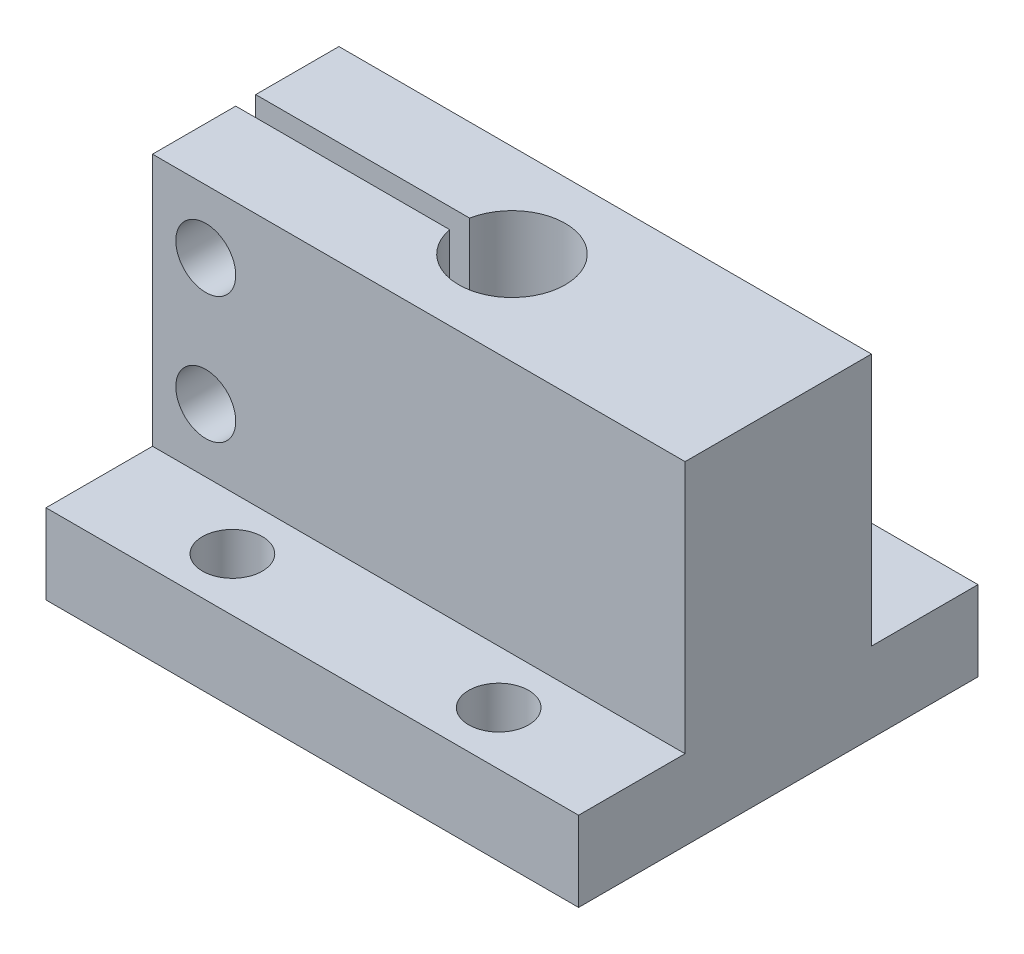
from build123d import *

# Parameters (mm, degrees)
SKETCH2_W               = 40
SKETCH2_H               = 14
SKETCH2_R               = 4
BOSS_EXTRUDE_WALL_DEPTH = 25
SKETCH2_3_W             = 40
SKETCH2_3_H             = 8
SKETCH2_3_R             = 2.25
BOSS_EXTRUDE2_DEPTH     = 6
SKETCH3_W               = 20
SKETCH3_H               = 1.5
CUT_EXTRUDE1_DEPTH      = 36.355339059
SKETCH4_R               = 2.25
CUT_EXTRUDE2_DEPTH      = 39.845849199


with BuildPart() as part:
    # Sketch2 → Boss-Extrude_wall (new body)
    with BuildSketch(Plane(origin=(0, 0, 0), x_dir=(1, 0, 0), z_dir=(0, 1, 0))):
        Rectangle(SKETCH2_W, SKETCH2_H)
        Circle(SKETCH2_R, mode=Mode.SUBTRACT)
    extrude(amount=BOSS_EXTRUDE_WALL_DEPTH)

    # Sketch2<3> → Boss-Extrude2 (add)
    # profile 1 of 2: a face of its own
    with BuildSketch(Plane(origin=(0, 0, 0), x_dir=(1, 0, 0), z_dir=(0, 1, 0))):
        with Locations((0, 11)):
            Rectangle(SKETCH2_3_W, SKETCH2_3_H)
        with Locations((-10, 11)):
            Circle(SKETCH2_3_R, mode=Mode.SUBTRACT)
        with Locations((10, 11)):
            Circle(SKETCH2_3_R, mode=Mode.SUBTRACT)
    # profile 2 of 2: a face of its own
    with BuildSketch(Plane(origin=(0, 0, 0), x_dir=(1, 0, 0), z_dir=(0, 1, 0))):
        with Locations((0, -11)):
            Rectangle(SKETCH2_3_W, SKETCH2_3_H)
        with Locations((-10, -11)):
            Circle(SKETCH2_3_R, mode=Mode.SUBTRACT)
        with Locations((10, -11)):
            Circle(SKETCH2_3_R, mode=Mode.SUBTRACT)
    extrude(amount=BOSS_EXTRUDE2_DEPTH)

    # Sketch3 → Cut-Extrude1 (cut, through all)
    with BuildSketch(Plane(origin=(0, 25, 0), x_dir=(1, 0, 0), z_dir=(0, 1, 0))):
        with Locations((-10, 0)):
            Rectangle(SKETCH3_W, SKETCH3_H)
    extrude(amount=-CUT_EXTRUDE1_DEPTH, mode=Mode.SUBTRACT)

    # Sketch4 → Cut-Extrude2 (cut, through all)
    with BuildSketch(Plane.XY.offset(7)):
        with Locations((-16, 20.25)):
            Circle(SKETCH4_R)
        with Locations((-16, 10.75)):
            Circle(SKETCH4_R)
    extrude(amount=-CUT_EXTRUDE2_DEPTH, mode=Mode.SUBTRACT)


solid = part.part
